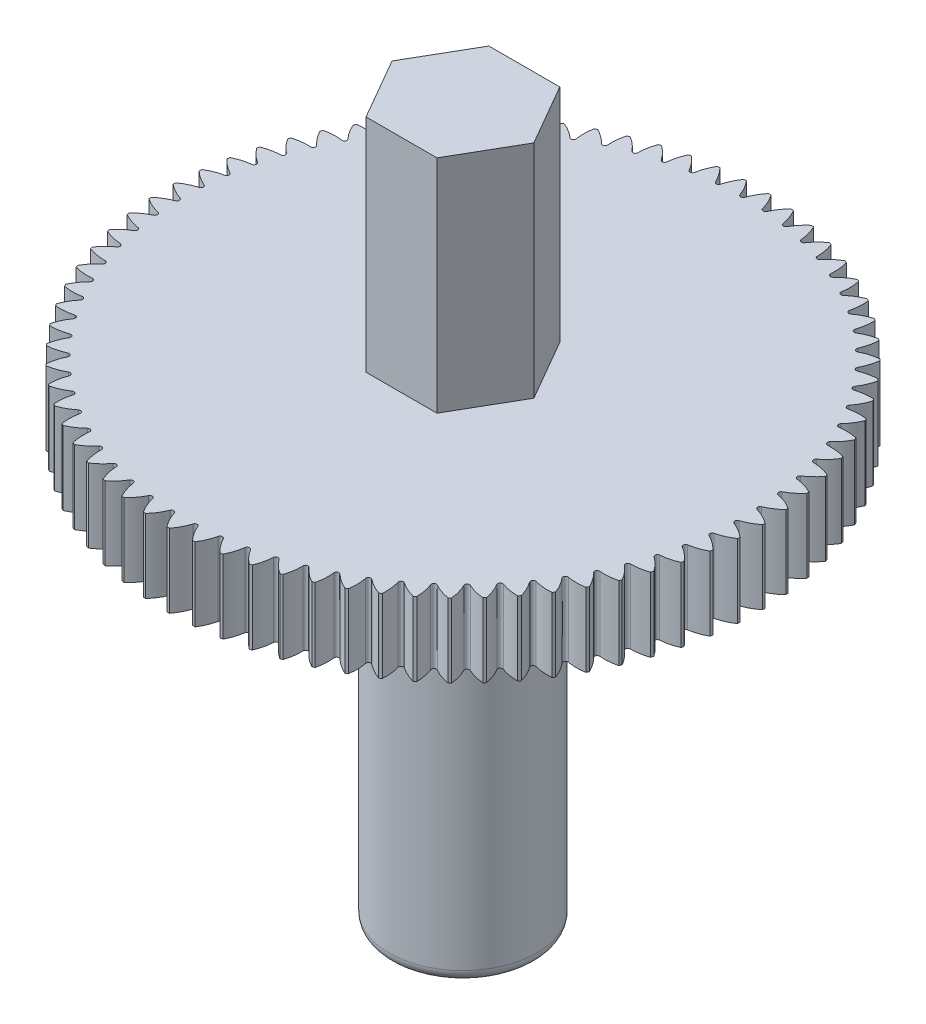
from build123d import *

# Parameters (mm, degrees)
FILLET1_R          = 0.5
CUT_EXTRUDE5_START = -9
SKETCH7_R          = 3
CUT_EXTRUDE5_DEPTH = 9
CUT_EXTRUDE7_START = -4
CUT_EXTRUDE7_DEPTH = 4
CIRPATTERN2_COUNT  = 75


with BuildPart() as part:
    # Sketch2 → Revolve1 (revolve)
    with BuildSketch(Plane(origin=(0, 0, 0), x_dir=(0, 0, -1), z_dir=(1, 0, 0))):
        Polygon((0, 0), (0, 29), (3, 29), (3, 20), (12, 20), (12, 17), (3, 17), (3, 0), align=None)
    revolve(axis=Axis((0, 0, 0), (0, 1, 0)))

    # Fillet1
    fillet1_edges = [part.edges().sort_by_distance(p)[0] for p in [
        (0, 0, 3),
    ]]
    fillet(fillet1_edges, radius=FILLET1_R)

    # Sketch7 → Cut-Extrude5 (cut)
    with BuildSketch(Plane(origin=(0, 29, 0), x_dir=(1, 0, 0), z_dir=(0, 1, 0)).offset(CUT_EXTRUDE5_START)):
        with Locations(Location((0, 0, 0), (0, 0, 90))):
            Circle(SKETCH7_R)
        Polygon((1.443375673, -2.5), (2.886751346, 0), (1.443375673, 2.5), (-1.443375673, 2.5), (-2.886751346, 0), (-1.443375673, -2.5), align=None, mode=Mode.SUBTRACT)
    extrude(amount=CUT_EXTRUDE5_DEPTH, mode=Mode.SUBTRACT)

    # Sketch12 → Cut-Extrude7 (cut)
    with BuildSketch(Plane(origin=(0, 20, 0), x_dir=(1, 0, 0), z_dir=(0, 1, 0)).offset(CUT_EXTRUDE7_START)):
        with BuildLine():
            ThreePointArc((-0.094236566, 11.371443523), (-0.057680813, 11.323214034), (0, 11.304902))
            Line((0, 11.304902), (0, 12))
            ThreePointArc((0, 12), (-0.225039575, 11.997889697), (-0.45, 11.991559532))
            ThreePointArc((-0.45, 11.991559532), (-0.244185037, 11.69752696), (-0.094236566, 11.371443523))
        make_face()
        with BuildLine():
            Line((0, 12), (0, 11.304902))
            ThreePointArc((0, 11.304902), (0.057680813, 11.323214034), (0.094236566, 11.371443523))
            ThreePointArc((0.094236566, 11.371443523), (0.244185037, 11.69752696), (0.45, 11.991559532))
            ThreePointArc((0.45, 11.991559532), (0.225039575, 11.997889697), (0, 12))
        make_face()
    cut_extrude7 = extrude(amount=CUT_EXTRUDE7_DEPTH, mode=Mode.SUBTRACT)

    # CirPattern2: Cut-Extrude7 ×75 about axis
    cirpattern2_axis = Axis((0, 0, 0), (0, 1, 0))
    for i in range(1, CIRPATTERN2_COUNT):
        add(cut_extrude7.rotate(cirpattern2_axis, i * 360 / CIRPATTERN2_COUNT), mode=Mode.SUBTRACT)


solid = part.part
